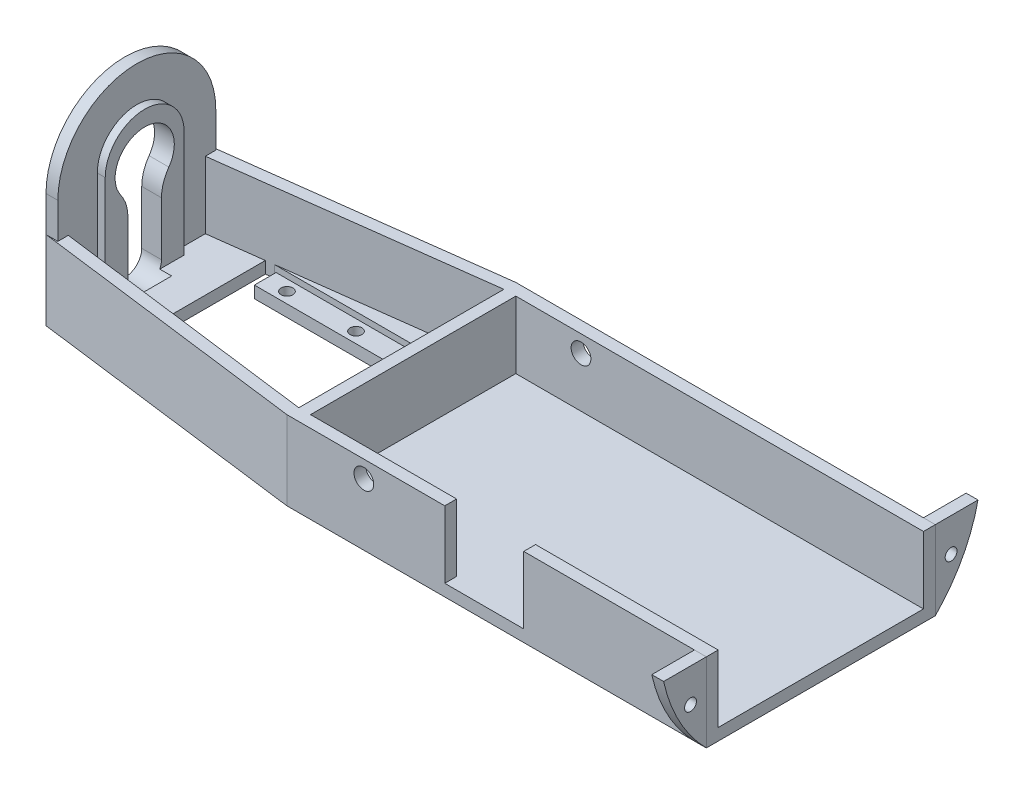
from build123d import *

# Parameters (mm, degrees)
SKETCH2_W               = 106.25
SKETCH2_H               = 58
BOSS_EXTRUDE1_DEPTH     = 3
SKETCH3_W               = 103.25
SKETCH3_H               = 3
BOSS_EXTRUDE2_DEPTH     = 20
SKETCH4_W               = 3
SKETCH4_H               = 40
BOSS_EXTRUDE3_DEPTH     = 29
BOSS_EXTRUDE4_DEPTH     = 17
SKETCH6_R               = 20
BOSS_EXTRUDE5_DEPTH     = 3
SKETCH19_R              = 1.5
BOSS_EXTRUDE9_DEPTH     = 2
CUT_EXTRUDE3_DEPTH      = 142.370302751
CUT_EXTRUDE3_DEPTH_BACK = 142.370302751
SKETCH10_R              = 2.5
SKETCH16_R              = 1.5
BOSS_EXTRUDE8_DEPTH     = 3
BOSS_EXTRUDE8_2_DEPTH   = 3
SKETCH18_W              = 20
SKETCH18_H              = 17
CUT_EXTRUDE5_DEPTH      = 3
SKETCH20_R              = 7.5
CUT_EXTRUDE6_DEPTH      = 8
FILLET1_R               = 10
SKETCH21_R              = 1.5
SKETCH21_W              = 45.5
SKETCH21_H              = 25
CUT_EXTRUDE7_DEPTH      = 3
SKETCH23_W              = 2
SKETCH23_H              = 5.5
CUT_EXTRUDE8_DEPTH      = 3
CUT_EXTRUDE9_DEPTH      = 3


with BuildPart() as part:
    # Sketch2 → Boss-Extrude1 (new body)
    with BuildSketch(Plane(origin=(0, 0, 0), x_dir=(1, 0, 0), z_dir=(0, 1, 0))):
        Polygon((-119.25, 20), (-49.25, 29), (-49.25, -29), (-119.25, -20), align=None)
        with Locations((3.875, 0)):
            Rectangle(SKETCH2_W, SKETCH2_H)
    extrude(amount=BOSS_EXTRUDE1_DEPTH)

    # Sketch3 → Boss-Extrude2 (add)
    with BuildSketch(Plane.XZ):
        with Locations((5.375, 27.5)):
            Rectangle(SKETCH3_W, SKETCH3_H)
        Polygon((-46.25, 29), (-49.25, 29), (-49.25, 25.975305716), (-49.25, -25.975305716), (-49.25, -29), (-46.25, -29), (-46.25, -26), (-46.25, 26), align=None)
        with Locations((5.375, -27.5)):
            Rectangle(SKETCH3_W, SKETCH3_H)
    extrude(amount=-BOSS_EXTRUDE2_DEPTH)

    # Sketch4 → Boss-Extrude3 (add)
    with BuildSketch(Plane.XZ):
        with Locations((-117.75, 0)):
            Rectangle(SKETCH4_W, SKETCH4_H)
    extrude(amount=-BOSS_EXTRUDE3_DEPTH)

    # Sketch5 → Boss-Extrude4 (add)
    with BuildSketch(Plane(origin=(0, 3, 0), x_dir=(1, 0, 0), z_dir=(0, 1, 0))):
        Polygon((-49.25, 25.975305716), (-116.25, 17.361020002), (-119.25, 20), (-49.25, 29), align=None)
        Polygon((-49.25, -25.975305716), (-116.25, -17.361020002), (-119.25, -20), (-49.25, -29), align=None)
    extrude(amount=BOSS_EXTRUDE4_DEPTH)

    # Sketch6 → Boss-Extrude5 (add)
    with BuildSketch(Plane.ZY.offset(119.25)):
        with Locations((0, 29)):
            Circle(SKETCH6_R)
    extrude(amount=-BOSS_EXTRUDE5_DEPTH)

    # Sketch19 → Boss-Extrude9 (add)
    with BuildSketch(Plane(origin=(-116.25, 0, 0), x_dir=(0, 0, -1), z_dir=(1, 0, 0))):
        with BuildLine():
            Line((-9.999999939, 30), (-9.999999939, 0))
            Line((-9.999999939, 0), (9.999999939, 0))
            Line((9.999999939, 0), (9.999999939, 30))
            ThreePointArc((9.999999939, 30), (0, 39.999999939), (-9.999999939, 30))
        make_face()
        with Locations((0, 30)):
            Circle(SKETCH19_R, mode=Mode.SUBTRACT)
    extrude(amount=BOSS_EXTRUDE9_DEPTH)

    # Sketch10 → Cut-Extrude3 (cut, two sides: drawn at the far end of the back side and taken through both)
    with BuildSketch(Plane.XY.offset(29).offset(-CUT_EXTRUDE3_DEPTH_BACK)):
        with Locations((-29.74, 15.69746)):
            Circle(SKETCH10_R)
    extrude(amount=CUT_EXTRUDE3_DEPTH + CUT_EXTRUDE3_DEPTH_BACK, mode=Mode.SUBTRACT)

    # Sketch18 → Cut-Extrude5 (cut)
    with BuildSketch(Plane.XY.offset(29)):
        with Locations((0.75, 11.5)):
            Rectangle(SKETCH18_W, SKETCH18_H)
    extrude(amount=-CUT_EXTRUDE5_DEPTH, mode=Mode.SUBTRACT)

    # Sketch20 → Cut-Extrude6 (cut)
    with BuildSketch(Plane.ZY.offset(119.25)):
        with Locations((0, 28.6)):
            Circle(SKETCH20_R)
        with BuildLine():
            Line((-4.25, 28.6), (-4.25, 4.85))
            ThreePointArc((-4.25, 4.85), (0, 0.6), (4.25, 4.85))
            Line((4.25, 4.85), (4.25, 28.6))
            ThreePointArc((4.25, 28.6), (0, 32.85), (-4.25, 28.6))
        make_face()
    extrude(amount=-CUT_EXTRUDE6_DEPTH, mode=Mode.SUBTRACT)

    # Fillet1
    fillet1_edges = [part.edges().sort_by_distance(p)[0] for p in [
        (-116.75, 22.420396453, -4.25),
        (-116.75, 22.420396453, 4.25),
    ]]
    fillet(fillet1_edges, radius=FILLET1_R)

    # Sketch21 → Cut-Extrude7 (cut)
    with BuildSketch(Plane(origin=(0, 0, 0), x_dir=(-1, 0, 0), z_dir=(0, -1, 0))):
        with Locations(Location((93.281180611, -15.44093997, 0), (0, 0, 90))):
            Circle(SKETCH21_R)
        with Locations(Location((75.781180611, -15.44093997, 0), (0, 0, 90))):
            Circle(SKETCH21_R)
        with Locations(Location((58.781180611, -15.44093997, 0), (0, 0, 90))):
            Circle(SKETCH21_R)
        with Locations(Location((52.531180611, -7.69093997, 0), (0, 0, 90))):
            Circle(SKETCH21_R)
        with Locations(Location((52.531180611, 7.30906003, 0), (0, 0, 90))):
            Circle(SKETCH21_R)
        with Locations(Location((58.781180611, 15.05906003, 0), (0, 0, 90))):
            Circle(SKETCH21_R)
        with Locations(Location((75.781180611, 15.05906003, 0), (0, 0, 90))):
            Circle(SKETCH21_R)
        with Locations(Location((93.281180611, 15.05906003, 0), (0, 0, 90))):
            Circle(SKETCH21_R)
        with Locations((78.031180611, -0.19093997)):
            Rectangle(SKETCH21_W, SKETCH21_H)
    extrude(amount=-CUT_EXTRUDE7_DEPTH, mode=Mode.SUBTRACT)

    # Sketch23 → Cut-Extrude8 (cut)
    with BuildSketch(Plane(origin=(0, 3, 0), x_dir=(1, 0, 0), z_dir=(0, 1, 0))):
        with Locations((-99.781180611, 15.05906003)):
            Rectangle(SKETCH23_W, SKETCH23_H)
        Polygon((-100.781180611, 19.349868209), (-100.781180611, 17.80906003), (-98.781180611, 17.80906003), (-49.25, 17.80906003), (-49.25, 19.349868209), align=None)
        with Locations((-99.781180611, -15.44093997)):
            Rectangle(SKETCH23_W, SKETCH23_H)
        Polygon((-98.781180611, -18.19093997), (-100.781180611, -18.19093997), (-100.781180611, -19.73174815), (-49.25, -19.73174815), (-49.25, -18.19093997), align=None)
    extrude(amount=-CUT_EXTRUDE8_DEPTH, mode=Mode.SUBTRACT)

    # Sketch24 → Cut-Extrude9 (cut)
    with BuildSketch(Plane(origin=(0, 3, 0), x_dir=(1, 0, 0), z_dir=(0, 1, 0))):
        Polygon((-100.781180611, 19.349868209), (-100.781180611, -19.349868209), (-102.781180611, -19.092725352), (-102.781180611, 19.092725352), align=None)
    extrude(amount=-CUT_EXTRUDE9_DEPTH, mode=Mode.SUBTRACT)


with BuildPart() as body_2:
    # Sketch16 → Boss-Extrude8 (new body)
    with BuildSketch(Plane(origin=(57, 0, 0), x_dir=(0, 0, -1), z_dir=(1, 0, 0))):
        with BuildLine():
            Line((-29, 20), (-39.812058475, 20))
            ThreePointArc((-39.812058475, 20), (-35.829803905, 9.230303252), (-29, 0))
            Line((-29, 0), (-29, 20))
        make_face()
        with Locations((-33, 11.5)):
            Circle(SKETCH16_R, mode=Mode.SUBTRACT)
    extrude(amount=-BOSS_EXTRUDE8_DEPTH)


with BuildPart() as body_3:
    # Sketch16 → Boss-Extrude8 2 (new body)
    with BuildSketch(Plane(origin=(57, 0, 0), x_dir=(0, 0, -1), z_dir=(1, 0, 0))):
        with BuildLine():
            Line((29, 20), (39.812058475, 20))
            ThreePointArc((39.812058475, 20), (35.829803905, 9.230303252), (29, 0))
            Line((29, 0), (29, 20))
        make_face()
        with Locations((33, 11.5)):
            Circle(SKETCH16_R, mode=Mode.SUBTRACT)
    extrude(amount=-BOSS_EXTRUDE8_2_DEPTH)


solid = Compound([part.part, body_2.part, body_3.part])
